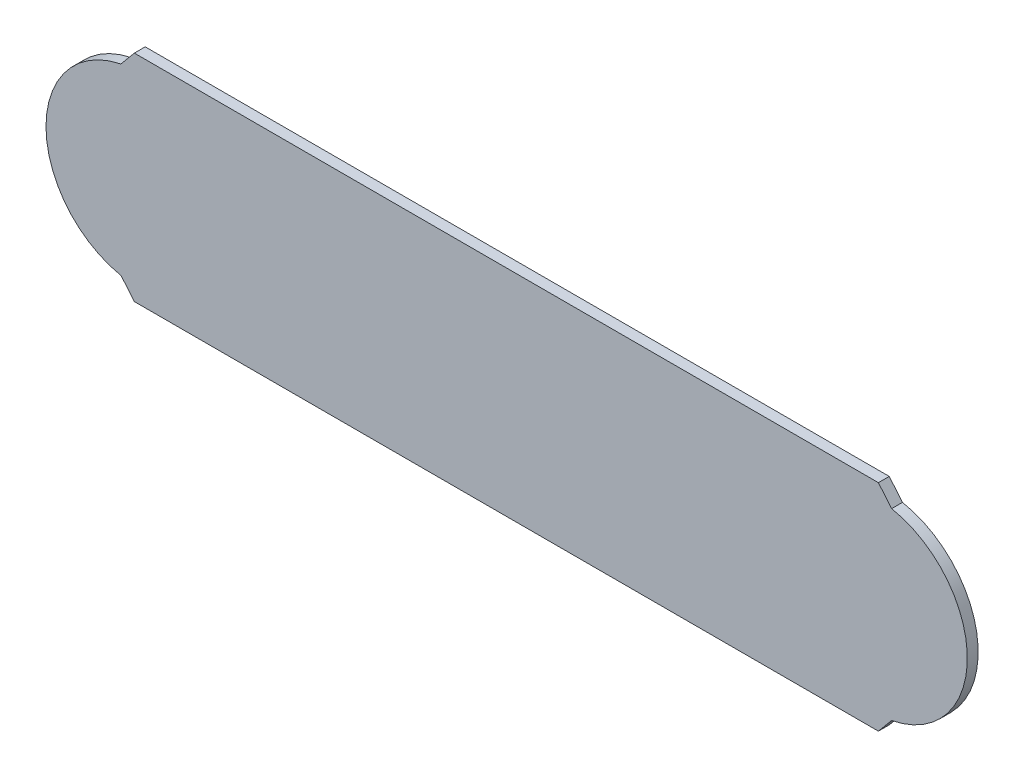
from build123d import *

# Parameters (mm, degrees)
BOSS_EXTRUDE1_DEPTH = 2
SCALE1_SCALE        = 0.6


with BuildPart() as part:
    # Sketch1 → Boss-Extrude1 (new body)
    with BuildSketch(Plane.XY):
        with BuildLine():
            Line((-87.945199987, 16.915862102), (-85.508172497, 19.844172117))
            Line((-85.508172497, 19.844172117), (51.705430776, 19.844172117))
            Line((51.705430776, 19.844172117), (54.142458266, 16.915862102))
            ThreePointArc((54.142458266, 16.915862102), (68.102505257, 0), (54.142458266, -16.915862102))
            Line((54.142458266, -16.915862102), (51.705430776, -19.844172117))
            Line((51.705430776, -19.844172117), (-85.508172497, -19.844172117))
            Line((-85.508172497, -19.844172117), (-87.945199987, -16.915862102))
            ThreePointArc((-87.945199987, -16.915862102), (-101.800450477, -0.05365779), (-88.010047693, 16.861622033))
            ThreePointArc((-88.010047693, 16.861622033), (-87.975174361, 16.885813548), (-87.945199987, 16.915862102))
        make_face()
    extrude(amount=BOSS_EXTRUDE1_DEPTH)


with BuildPart() as part_1:
    # Scale1: scaled about (-16.855793262, -0.001137482, 1)
    add(part.part.scale(SCALE1_SCALE).moved(Location((-6.742317305, -0.000454993, 0.4))))


solid = part_1.part
